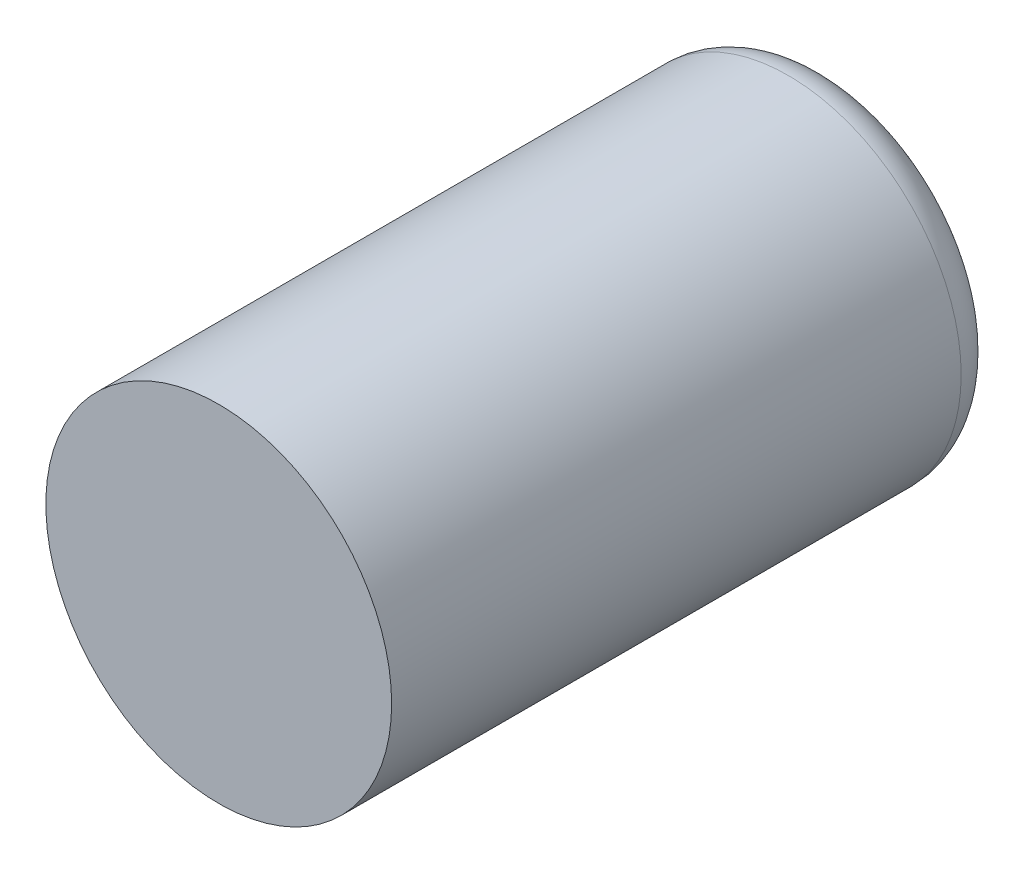
from build123d import *


with BuildPart() as part:
    # Sketch1 → Revolve1 (revolve)
    with BuildSketch(Plane(origin=(0, 0, 0), x_dir=(1, 0, 0), z_dir=(0, 1, 0))):
        with BuildLine():
            Line((6.5, 0), (0, 0))
            Line((0, 0), (0, -30))
            Line((0, -30), (8.5, -30))
            Line((8.5, -30), (8.5, -2))
            ThreePointArc((8.5, -2), (7.914213562, -0.585786438), (6.5, 0))
        make_face()
    revolve(axis=Axis((0, 0, -0.001253994), (0, 0, 1)))


solid = part.part
